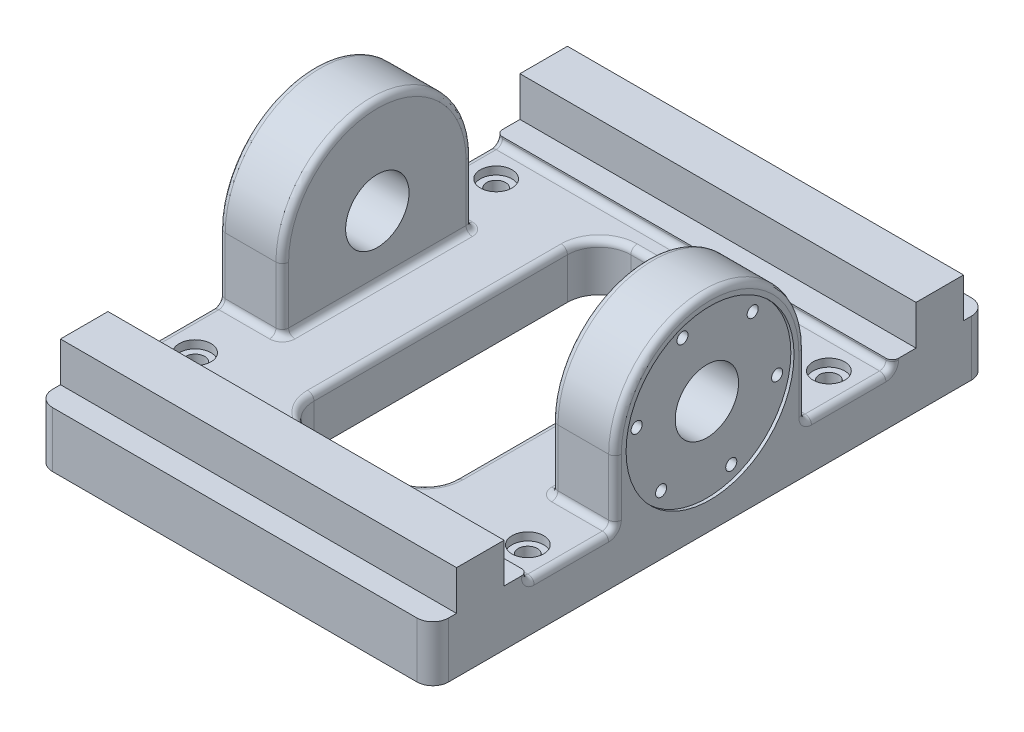
from build123d import *

# Parameters (mm, degrees)
SKETCH1_W               = 250
SKETCH1_H               = 350
EXTRUDE1_DEPTH          = 30
CUT_EXTRUDE10_DEPTH     = 100
SKETCH2_W               = 250
SKETCH2_H               = 30
EXTRUDE2_DEPTH          = 30
SKETCH7_W               = 250
SKETCH7_H               = 60
EXTRUDE6_DEPTH          = 5
EXTRUDE3_DEPTH          = 40
SKETCH11_R              = 53
CUT_EXTRUDE7_DEPTH      = 2
SKETCH10_R              = 3.5
CUT_EXTRUDE6_DEPTH      = 30
CIRPATTERN1_COUNT       = 6
MIRROR2_COPY_1_SKETCH_R = 3.5
MIRROR2_COPY_1_DEPTH    = 30
MIRROR2_COPY_2_SKETCH_R = 3.5
MIRROR2_COPY_2_DEPTH    = 30
MIRROR2_COPY_3_SKETCH_R = 3.5
MIRROR2_COPY_3_DEPTH    = 30
MIRROR2_COPY_4_SKETCH_R = 3.5
MIRROR2_COPY_4_DEPTH    = 30
MIRROR2_COPY_5_SKETCH_R = 3.5
MIRROR2_COPY_5_DEPTH    = 30
CUT_EXTRUDE1_DEPTH      = 252.296637463
CUT_EXTRUDE1_DEPTH_BACK = 252.296637463
SKETCH6_R               = 20
HOLE2_D                 = 12
HOLE2_CBORE_D           = 20
HOLE2_CBORE_DEPTH       = 5
LPATTERN1_COUNT         = 2
LPATTERN1_PITCH         = 190
LPATTERN1_COUNT_DIR2    = 2
LPATTERN1_PITCH_DIR2    = 210
FILLET1_R               = 4
FILLET2_R               = 10


with BuildPart() as part:
    # Sketch1 → Extrude1 (new body)
    with BuildSketch(Plane(origin=(0, 0, 0), x_dir=(1, 0, 0), z_dir=(0, 1, 0))):
        Rectangle(SKETCH1_W, SKETCH1_H)
    extrude(amount=EXTRUDE1_DEPTH)

    # Sketch21 → Cut-Extrude10 (cut)
    with BuildSketch(Plane(origin=(0, 30, 0), x_dir=(-1, 0, 0), z_dir=(0, 1, 0))):
        with BuildLine():
            Line((-25, -100), (25, -100))
            ThreePointArc((25, -100), (39.142135624, -94.142135624), (45, -80))
            Line((45, -80), (45, 80))
            ThreePointArc((45, 80), (39.142135624, 94.142135624), (25, 100))
            Line((25, 100), (-25, 100))
            ThreePointArc((-25, 100), (-39.142135624, 94.142135624), (-45, 80))
            Line((-45, 80), (-45, -80))
            ThreePointArc((-45, -80), (-39.142135624, -94.142135624), (-25, -100))
        make_face()
    extrude(amount=-CUT_EXTRUDE10_DEPTH, mode=Mode.SUBTRACT)

    # Sketch2 → Extrude2 (add)
    with BuildSketch(Plane(origin=(0, 30, 0), x_dir=(-1, 0, 0), z_dir=(0, 1, 0))):
        with Locations((0, 145)):
            Rectangle(SKETCH2_W, SKETCH2_H)
    extrude2 = extrude(amount=EXTRUDE2_DEPTH)

    # Sketch7 → Extrude6 (add)
    with BuildSketch(Plane(origin=(0, 30, 0), x_dir=(-1, 0, 0), z_dir=(0, 1, 0))):
        with Locations((0, 145)):
            Rectangle(SKETCH7_W, SKETCH7_H)
    extrude6 = extrude(amount=EXTRUDE6_DEPTH)

    # Mirror1: Extrude2, Extrude6 across plane
    add(extrude2.mirror(Plane.XY))
    add(extrude6.mirror(Plane.XY))

    # Sketch3 → Extrude3 (add)
    with BuildSketch(Plane(origin=(-125, 0, 0), x_dir=(0, 0, -1), z_dir=(1, 0, 0))):
        with BuildLine():
            Line((-60, 70), (-60, 30))
            Line((-60, 30), (60, 30))
            Line((60, 30), (60, 70))
            ThreePointArc((60, 70), (0, 130), (-60, 70))
        make_face()
    extrude3 = extrude(amount=EXTRUDE3_DEPTH)

    # Sketch11 → Cut-Extrude7 (cut)
    with BuildSketch(Plane.ZY.offset(125)):
        with Locations((0, 70)):
            Circle(SKETCH11_R)
    cut_extrude7 = extrude(amount=-CUT_EXTRUDE7_DEPTH, mode=Mode.SUBTRACT)

    # Sketch10 → Cut-Extrude6 (cut)
    with BuildSketch(Plane.ZY.offset(125)):
        with Locations((15.39090645, 112.286167935)):
            Circle(SKETCH10_R)
    cut_extrude6 = extrude(amount=-CUT_EXTRUDE6_DEPTH, mode=Mode.SUBTRACT)

    # CirPattern1: Cut-Extrude6 ×6 about axis
    cirpattern1_axis = Axis((0, 70, 0), (1, 0, 0))
    for i in range(1, CIRPATTERN1_COUNT):
        add(cut_extrude6.rotate(cirpattern1_axis, i * 360 / CIRPATTERN1_COUNT), mode=Mode.SUBTRACT)

    # Mirror2: Extrude3, Cut-Extrude7, Cut-Extrude6 across plane
    add(extrude3.mirror(Plane(origin=(0, 0, 0), x_dir=(0, 0, 1), z_dir=(1, 0, 0))))
    add(cut_extrude7.mirror(Plane(origin=(0, 0, 0), x_dir=(0, 0, 1), z_dir=(1, 0, 0))), mode=Mode.SUBTRACT)
    add(cut_extrude6.mirror(Plane(origin=(0, 0, 0), x_dir=(0, 0, 1), z_dir=(1, 0, 0))), mode=Mode.SUBTRACT)

    # Mirror2 copy 1 sketch → Mirror2 copy 1 (cut)
    with BuildSketch(Plane(origin=(125, 35, -60.621778265), x_dir=(0, -0.8660254037844386, 0.5000000000000001), z_dir=(1, 0, 0))):
        with Locations((15.39090645, -112.286167935)):
            Circle(MIRROR2_COPY_1_SKETCH_R)
    extrude(amount=-MIRROR2_COPY_1_DEPTH, mode=Mode.SUBTRACT)

    # Mirror2 copy 2 sketch → Mirror2 copy 2 (cut)
    with BuildSketch(Plane(origin=(125, 105, -60.621778265), x_dir=(0, -0.8660254037844387, -0.4999999999999998), z_dir=(1, 0, 0))):
        with Locations((15.39090645, -112.286167935)):
            Circle(MIRROR2_COPY_2_SKETCH_R)
    extrude(amount=-MIRROR2_COPY_2_DEPTH, mode=Mode.SUBTRACT)

    # Mirror2 copy 3 sketch → Mirror2 copy 3 (cut)
    with BuildSketch(Plane(origin=(125, 140, 0), x_dir=(0, 0, -1), z_dir=(1, 0, 0))):
        with Locations((15.39090645, -112.286167935)):
            Circle(MIRROR2_COPY_3_SKETCH_R)
    extrude(amount=-MIRROR2_COPY_3_DEPTH, mode=Mode.SUBTRACT)

    # Mirror2 copy 4 sketch → Mirror2 copy 4 (cut)
    with BuildSketch(Plane(origin=(125, 105, 60.621778265), x_dir=(0, 0.8660254037844384, -0.5000000000000004), z_dir=(1, 0, 0))):
        with Locations((15.39090645, -112.286167935)):
            Circle(MIRROR2_COPY_4_SKETCH_R)
    extrude(amount=-MIRROR2_COPY_4_DEPTH, mode=Mode.SUBTRACT)

    # Mirror2 copy 5 sketch → Mirror2 copy 5 (cut)
    with BuildSketch(Plane(origin=(125, 35, 60.621778265), x_dir=(0, 0.8660254037844386, 0.5000000000000001), z_dir=(1, 0, 0))):
        with Locations((15.39090645, -112.286167935)):
            Circle(MIRROR2_COPY_5_SKETCH_R)
    extrude(amount=-MIRROR2_COPY_5_DEPTH, mode=Mode.SUBTRACT)

    # Sketch6 → Cut-Extrude1 (cut, two sides: drawn at the far end of the back side and taken through both)
    with BuildSketch(Plane(origin=(0, 0, 0), x_dir=(0, 0, -1), z_dir=(1, 0, 0)).offset(-CUT_EXTRUDE1_DEPTH_BACK)):
        with Locations((0, 70)):
            Circle(SKETCH6_R)
    extrude(amount=CUT_EXTRUDE1_DEPTH + CUT_EXTRUDE1_DEPTH_BACK, mode=Mode.SUBTRACT)

    # Hole2 (through all)
    with Locations(Plane(origin=(0, 30, 0), x_dir=(-1, 0, 0), z_dir=(0, 1, 0))):
        with Locations((-105, -95)):
            hole2 = CounterBoreHole(HOLE2_D / 2, HOLE2_CBORE_D / 2, HOLE2_CBORE_DEPTH)

    # LPattern1: Hole2 2 × 2
    with Locations(*[(-j * LPATTERN1_PITCH_DIR2, 0, i * LPATTERN1_PITCH) for i in range(LPATTERN1_COUNT) for j in range(LPATTERN1_COUNT_DIR2) if (i, j) != (0, 0)]):
        add(hole2, mode=Mode.SUBTRACT)

    # Fillet1
    fillet1_edges = [part.edges().sort_by_distance(p)[0] for p in [
        (-125, 30, -87.5),
        (125, 32.5, -115),
        (0, 30, -115),
        (-125, 32.5, -115),
        (-125, 30, 87.5),
        (-125, 130, 0),
        (-125, 50, 60),
        (-105, 30, 60),
        (-125, 50, -60),
        (-105, 30, -60),
        (-85, 130, 0),
        (-85, 50, 60),
        (-85, 30, 0),
        (-85, 50, -60),
        (125, 30, -87.5),
        (85, 130, 0),
        (85, 50, -60),
        (85, 30, 0),
        (105, 30, -60),
        (85, 50, 60),
        (105, 30, 60),
        (125, 130, 0),
        (125, 50, 60),
        (125, 50, -60),
        (39.142135624, 30, -94.142135624),
        (0, 30, -100),
        (-39.142135624, 30, -94.142135624),
        (-45, 30, 0),
        (-39.142135624, 30, 94.142135624),
        (0, 30, 100),
        (39.142135624, 30, 94.142135624),
        (45, 30, 0),
        (125, 30, 87.5),
        (-125, 32.5, 115),
        (0, 30, 115),
        (125, 32.5, 115),
    ]]
    fillet(fillet1_edges, radius=FILLET1_R)

    # Fillet2
    fillet2_edges = [part.edges().sort_by_distance(p)[0] for p in [
        (-125, 17.5, -175),
        (125, 17.5, -175),
        (125, 17.5, 175),
        (-125, 17.5, 175),
    ]]
    fillet(fillet2_edges, radius=FILLET2_R)


solid = part.part
